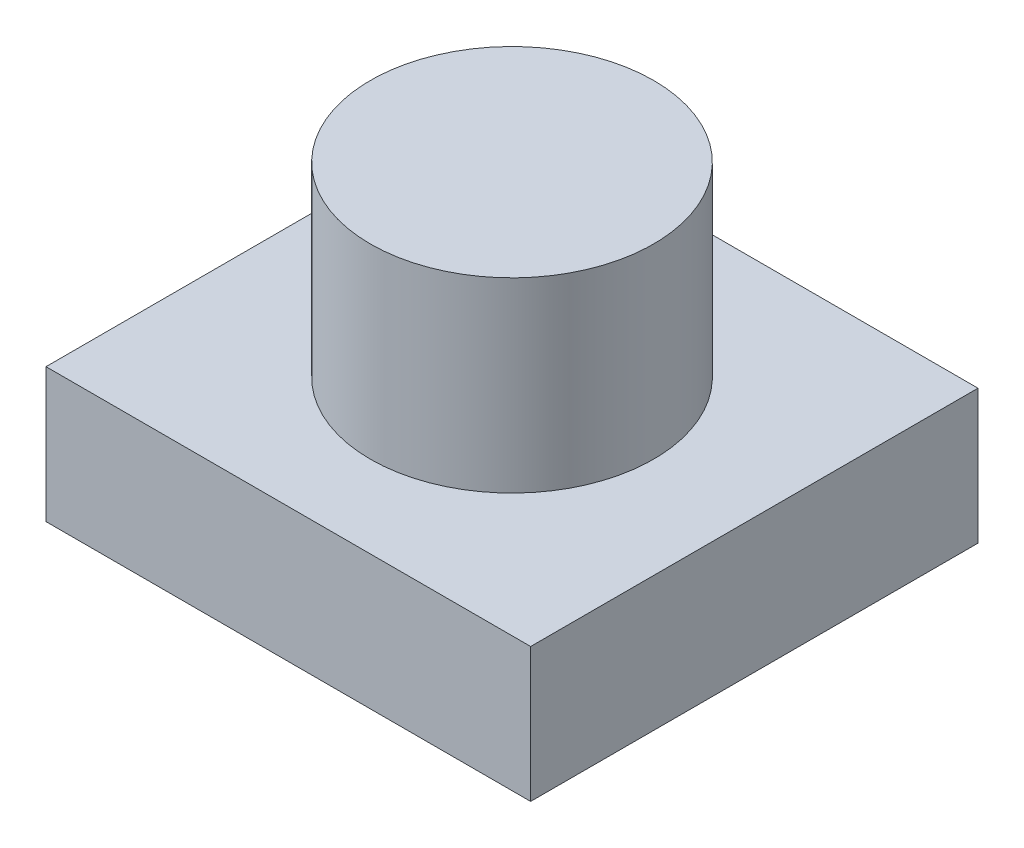
from build123d import *

# Parameters (mm, degrees)
SKETCH1_W           = 6.5
SKETCH1_H           = 6
BOSS_EXTRUDE1_DEPTH = 1.8
SKETCH2_R           = 1.9
BOSS_EXTRUDE2_DEPTH = 2.5


with BuildPart() as part:
    # Sketch1 → Boss-Extrude1 (new body)
    with BuildSketch(Plane(origin=(0, 0, 0), x_dir=(1, 0, 0), z_dir=(0, 1, 0))):
        with Locations((3.25, 3)):
            Rectangle(SKETCH1_W, SKETCH1_H)
    extrude(amount=BOSS_EXTRUDE1_DEPTH)

    # Sketch2 → Boss-Extrude2 (add)
    with BuildSketch(Plane(origin=(0, 1.8, 0), x_dir=(1, 0, 0), z_dir=(0, 1, 0))):
        with Locations(Location((3.25, 3, 0), (0, 0, 270))):
            Circle(SKETCH2_R)
    extrude(amount=BOSS_EXTRUDE2_DEPTH)


solid = part.part
